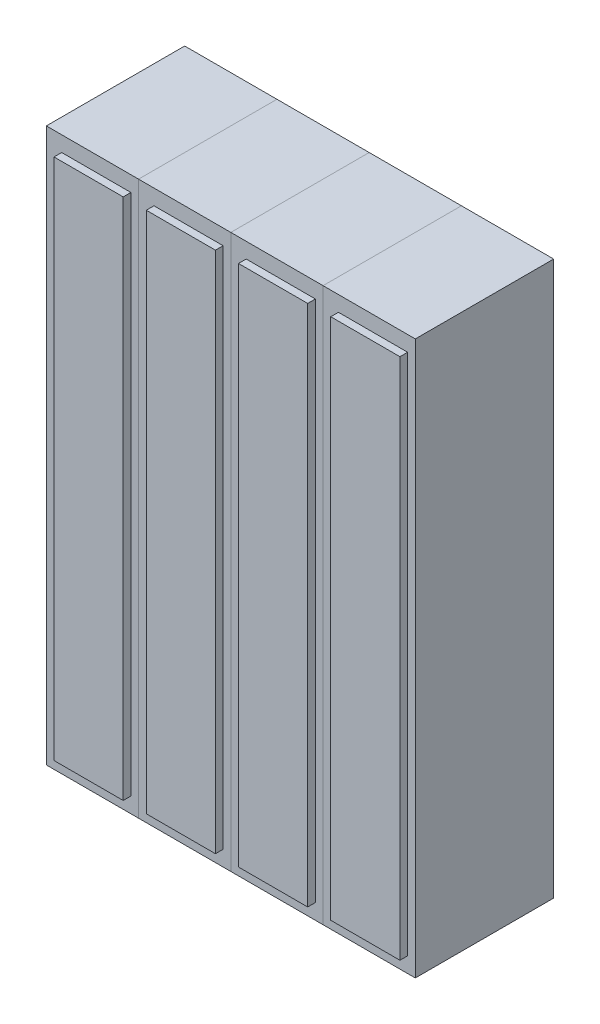
from build123d import *

# Parameters (mm, degrees)
SKETCH1_W           = 304.8
SKETCH1_H           = 457.2
BOSS_EXTRUDE1_DEPTH = 1828.8
SKETCH2_W           = 228.6
SKETCH2_H           = 1727.2
BOSS_EXTRUDE2_DEPTH = 25.4
LPATTERN1_COUNT     = 4
LPATTERN1_PITCH     = 304.8


with BuildPart() as part:
    # Sketch1 → Boss-Extrude1 (new body)
    with BuildSketch(Plane(origin=(0, 0, 0), x_dir=(1, 0, 0), z_dir=(0, 1, 0))):
        with Locations((152.4, -228.6)):
            Rectangle(SKETCH1_W, SKETCH1_H)
    extrude(amount=BOSS_EXTRUDE1_DEPTH)

    # Sketch2 → Boss-Extrude2 (add)
    with BuildSketch(Plane.XY.offset(457.2)):
        with Locations((165.1, 914.4)):
            Rectangle(SKETCH2_W, SKETCH2_H)
    extrude(amount=BOSS_EXTRUDE2_DEPTH)


with BuildPart() as lpattern1_1:
    # LPattern1: pattern copy
    add(part.part.moved(Location(Vector(1, 0, 0) * (1 * LPATTERN1_PITCH))))


with BuildPart() as lpattern1_2:
    # LPattern1: pattern copy
    add(part.part.moved(Location(Vector(1, 0, 0) * (2 * LPATTERN1_PITCH))))


with BuildPart() as lpattern1_3:
    # LPattern1: pattern copy
    add(part.part.moved(Location(Vector(1, 0, 0) * (3 * LPATTERN1_PITCH))))


solid = Compound([part.part, lpattern1_1.part, lpattern1_2.part, lpattern1_3.part])
